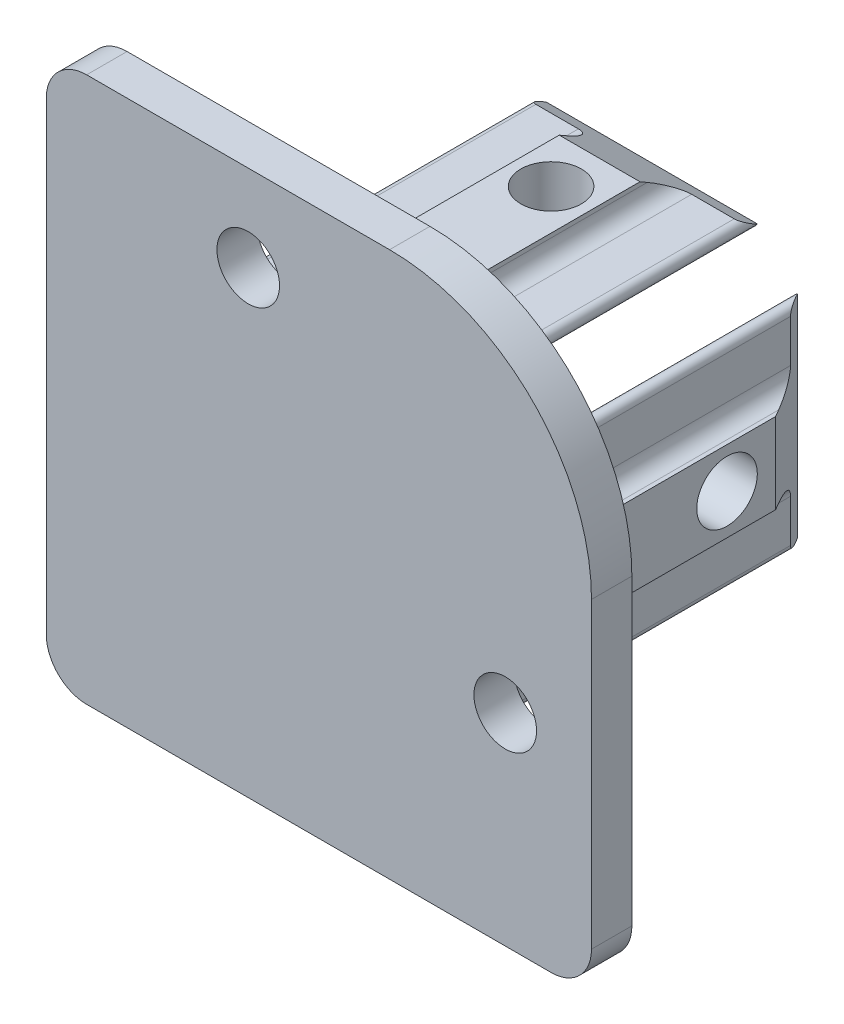
from build123d import *

# Parameters (mm, degrees)
BOSS_EXTRUDE2_DEPTH           = 20
CHAMFER2_SIZE                 = 1.5
CHAMFER2_SIZE2                = 2.598076211
SKETCH4_R                     = 1.5
CUT_EXTRUDE1_DEPTH            = 22.185810788
SKETCH6_W                     = 27
SKETCH6_H                     = 27
BOSS_EXTRUDE4_DEPTH           = 2
CIRPATTERN1_COUNT             = 4
CHAMFER2_OF_CIRPATTERN1_SIZE2 = 1.5
CHAMFER2_OF_CIRPATTERN1_SIZE  = 2.598076211
SKETCH10_R                    = 1.55
CUT_EXTRUDE3_DEPTH            = 32.272991606
FILLET1_R                     = 10
FILLET2_R                     = 2


with BuildPart() as part:
    # Sketch2 → Boss-Extrude2 (new body)
    with BuildSketch(Plane.XY):
        with BuildLine():
            Line((-2.860520074, 4.832233047), (-5.150943513, 7.122656487))
            ThreePointArc((-5.150943513, 7.122656487), (-5.224256058, 7.491223537), (-4.9118, 7.7))
            Line((-4.9118, 7.7), (-2.8048, 7.7))
            ThreePointArc((-2.8048, 7.7), (-2.235720463, 7.935720463), (-2, 8.5048))
            Line((-2, 8.5048), (-2, 8.7126))
            Line((-2, 8.7126), (2, 8.7126))
            Line((2, 8.7126), (2, 8.5048))
            ThreePointArc((2, 8.5048), (2.235720463, 7.935720463), (2.8048, 7.7))
            Line((2.8048, 7.7), (4.9118, 7.7))
            ThreePointArc((4.9118, 7.7), (5.224256058, 7.491223537), (5.150943513, 7.122656487))
            Line((5.150943513, 7.122656487), (2.860520074, 4.832233047))
            ThreePointArc((2.860520074, 4.832233047), (2.049461702, 4.290301169), (1.092753121, 4.1))
            Line((1.092753121, 4.1), (-1.092753121, 4.1))
            ThreePointArc((-1.092753121, 4.1), (-2.049461702, 4.290301169), (-2.860520074, 4.832233047))
        make_face()
    boss_extrude2 = extrude(amount=-BOSS_EXTRUDE2_DEPTH)

    # Chamfer2
    chamfer2_edges = [part.edges().sort_by_distance(p)[0] for p in [
        (0, 8.7126, -20),
    ]]
    chamfer2_side = [part.faces().sort_by_distance(p)[0] for p in [
        (0, 6.450366022, -20),
    ]]
    chamfer(chamfer2_edges, length=CHAMFER2_SIZE, length2=CHAMFER2_SIZE2, reference=chamfer2_side[0])

    # Sketch4 → Cut-Extrude1 (cut, through all)
    with BuildSketch(Plane(origin=(0, 8.7126, 0), x_dir=(1, 0, 0), z_dir=(0, 1, 0))):
        with Locations(Location((0, 15, 0), (0, 0, 270))):
            Circle(SKETCH4_R)
    cut_extrude1 = extrude(amount=-CUT_EXTRUDE1_DEPTH, mode=Mode.SUBTRACT)

    # Sketch6 → Boss-Extrude4 (add)
    with BuildSketch(Plane.XY):
        with Locations((3.5, 3.5)):
            Rectangle(SKETCH6_W, SKETCH6_H)
    extrude(amount=-BOSS_EXTRUDE4_DEPTH)

    # CirPattern1: Boss-Extrude2, Cut-Extrude1 ×4 about axis
    cirpattern1_axis = Axis((0, 0, 0), (0, 0, 1))
    add([boss_extrude2.rotate(cirpattern1_axis, i * 360 / CIRPATTERN1_COUNT) for i in range(1, CIRPATTERN1_COUNT)])
    add([cut_extrude1.rotate(cirpattern1_axis, i * 360 / CIRPATTERN1_COUNT) for i in range(1, CIRPATTERN1_COUNT)], mode=Mode.SUBTRACT)

    # Chamfer2 of CirPattern1
    chamfer2_of_cirpattern1_edges = [part.edges().sort_by_distance(p)[0] for p in [
        (-8.7126, 0, -20),
        (0, -8.7126, -20),
        (8.7126, 0, -20),
    ]]
    chamfer(chamfer2_of_cirpattern1_edges, length=CHAMFER2_OF_CIRPATTERN1_SIZE, length2=CHAMFER2_OF_CIRPATTERN1_SIZE2)

    # Sketch10 → Cut-Extrude3 (cut, through all)
    with BuildSketch(Plane.XY):
        with Locations((0, 12.727922061)):
            Circle(SKETCH10_R)
        with Locations((12.727922061, 0)):
            Circle(SKETCH10_R)
    extrude(amount=-CUT_EXTRUDE3_DEPTH, mode=Mode.SUBTRACT)

    # Fillet1
    fillet1_edges = [part.edges().sort_by_distance(p)[0] for p in [
        (17, 17, -1),
    ]]
    fillet(fillet1_edges, radius=FILLET1_R)

    # Fillet2
    fillet2_edges = [part.edges().sort_by_distance(p)[0] for p in [
        (-10, -10, -1),
        (-10, 17, -1),
        (17, -10, -1),
    ]]
    fillet(fillet2_edges, radius=FILLET2_R)


solid = part.part
